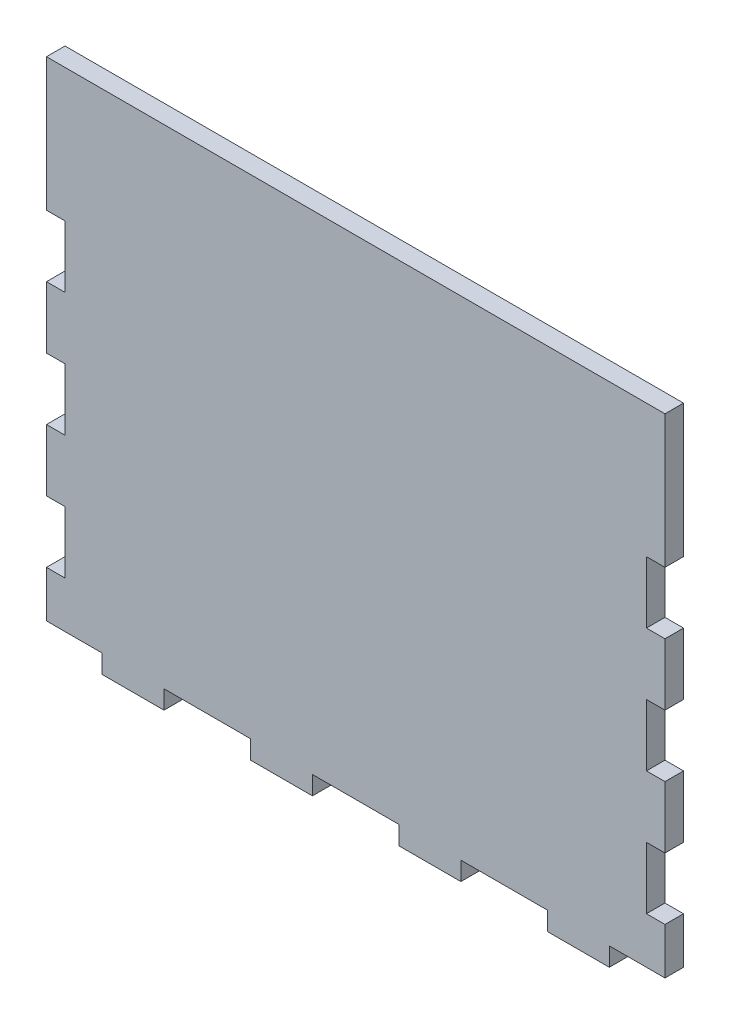
from build123d import *

# Parameters (mm, degrees)
SKETCH_1_W      = 10
SKETCH_1_H      = 3
EXTRUDE_1_DEPTH = 3


with BuildPart() as part:
    # 草圖1 → 填料-伸長1 (new body)
    with BuildSketch(Plane.XY):
        Polygon((29.080711207, 23.718072979), (38.080711207, 23.718072979), (38.080711207, 37.718072979), (-61.919288793, 37.718072979), (-61.919288793, 23.718072979), (-52.919288793, 23.718072979), (-52.919288793, 26.718072979), (-42.919288793, 26.718072979), (-42.919288793, 23.718072979), (-28.919288793, 23.718072979), (-28.919288793, 26.718072979), (-18.919288793, 26.718072979), (-18.919288793, 23.718072979), (-4.919288793, 23.718072979), (-4.919288793, 26.718072979), (5.080711207, 26.718072979), (5.080711207, 23.718072979), (19.080711207, 23.718072979), (19.080711207, 26.718072979), (29.080711207, 26.718072979), align=None)
        with Locations((-47.919288793, 25.218072979)):
            Rectangle(SKETCH_1_W, SKETCH_1_H)
        with Locations((-23.919288793, 25.218072979)):
            Rectangle(SKETCH_1_W, SKETCH_1_H)
        with Locations((0.080711207, 25.218072979)):
            Rectangle(SKETCH_1_W, SKETCH_1_H)
        with Locations((24.080711207, 25.218072979)):
            Rectangle(SKETCH_1_W, SKETCH_1_H)
        Polygon((-52.919288793, 23.718072979), (-61.919288793, 23.718072979), (-61.919288793, 16.218072979), (-58.919288793, 16.218072979), (-58.919288793, 6.218072979), (-61.919288793, 6.218072979), (-61.919288793, -3.781927021), (-58.919288793, -3.781927021), (-58.919288793, -13.781927021), (-61.919288793, -13.781927021), (-61.919288793, -23.781927021), (-58.919288793, -23.781927021), (-58.919288793, -33.781927021), (-61.919288793, -33.781927021), (-61.919288793, -41.281927021), (-52.919288793, -41.281927021), (-52.919288793, -44.281927021), (-42.919288793, -44.281927021), (-42.919288793, -41.281927021), (-28.919288793, -41.281927021), (-28.919288793, -44.281927021), (-18.919288793, -44.281927021), (-18.919288793, -41.281927021), (-4.919288793, -41.281927021), (-4.919288793, -44.281927021), (5.080711207, -44.281927021), (5.080711207, -41.281927021), (19.080711207, -41.281927021), (19.080711207, -44.281927021), (29.080711207, -44.281927021), (29.080711207, -41.281927021), (38.080711207, -41.281927021), (38.080711207, -33.781927021), (35.080711207, -33.781927021), (35.080711207, -23.781927021), (38.080711207, -23.781927021), (38.080711207, -13.781927021), (35.080711207, -13.781927021), (35.080711207, -3.781927021), (38.080711207, -3.781927021), (38.080711207, 6.218072979), (35.080711207, 6.218072979), (35.080711207, 16.218072979), (38.080711207, 16.218072979), (38.080711207, 23.718072979), (29.080711207, 23.718072979), (19.080711207, 23.718072979), (5.080711207, 23.718072979), (-4.919288793, 23.718072979), (-18.919288793, 23.718072979), (-28.919288793, 23.718072979), (-42.919288793, 23.718072979), align=None)
    extrude(amount=EXTRUDE_1_DEPTH)


solid = part.part
